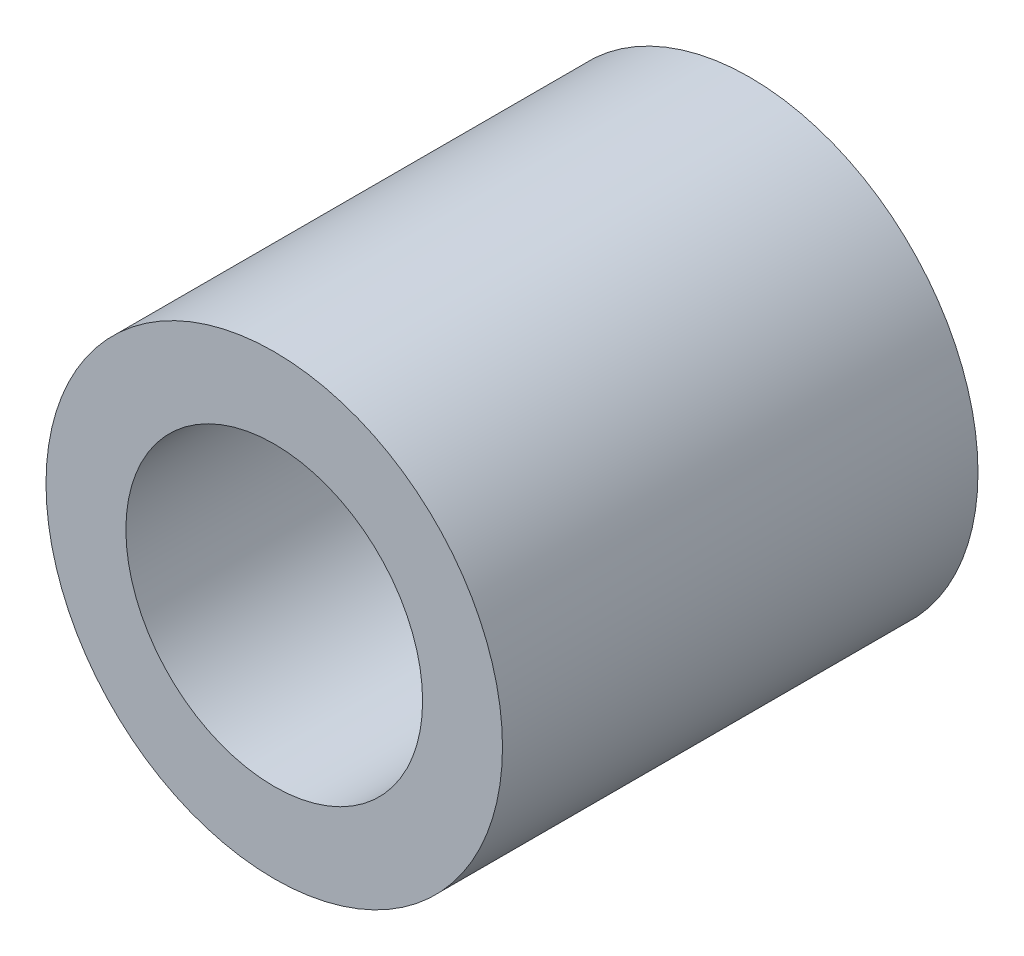
from build123d import *

# Parameters (mm, degrees)
SKETCH1_R           = 10.668
SKETCH1_R_2         = 6.9342
BOSS_EXTRUDE1_DEPTH = 22.225


with BuildPart() as part:
    # Sketch1 → Boss-Extrude1 (new body)
    with BuildSketch(Plane.XY):
        Circle(SKETCH1_R)
        Circle(SKETCH1_R_2, mode=Mode.SUBTRACT)
    extrude(amount=BOSS_EXTRUDE1_DEPTH)


solid = part.part
